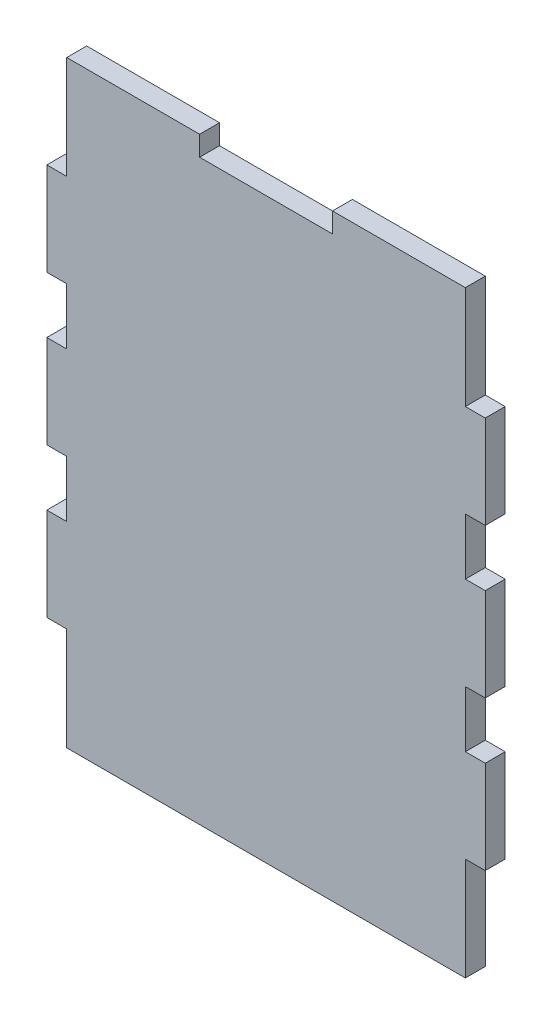
from build123d import *

# Parameters (mm, degrees)
BOSS_EXTRU_1_DEPTH      = 3
ESQUISSE2_W             = 20
ESQUISSE2_H             = 6
ENL_V_MAT_EXTRU_1_DEPTH = 10


with BuildPart() as part:
    # Esquisse1 → Boss.-Extru.1 (new body)
    with BuildSketch(Plane.XY):
        Polygon((-30, -45), (30, -45), (30, -29.5), (33, -29.5), (33, -15.5), (30, -15.5), (30, -7), (33, -7), (33, 7), (30, 7), (30, 15.5), (33, 15.5), (33, 29.5), (30, 29.5), (30, 45), (-30, 45), (-30, 29.5), (-33, 29.5), (-33, 15.5), (-30, 15.5), (-30, 7), (-33, 7), (-33, -7), (-30, -7), (-30, -15.5), (-33, -15.5), (-33, -29.5), (-30, -29.5), align=None)
    extrude(amount=BOSS_EXTRU_1_DEPTH)

    # Esquisse2 → Enlèv. mat.-Extru.1 (cut)
    with BuildSketch(Plane.XY.offset(3)):
        with Locations((0, 45)):
            Rectangle(ESQUISSE2_W, ESQUISSE2_H)
    extrude(amount=-ENL_V_MAT_EXTRU_1_DEPTH, mode=Mode.SUBTRACT)


solid = part.part
